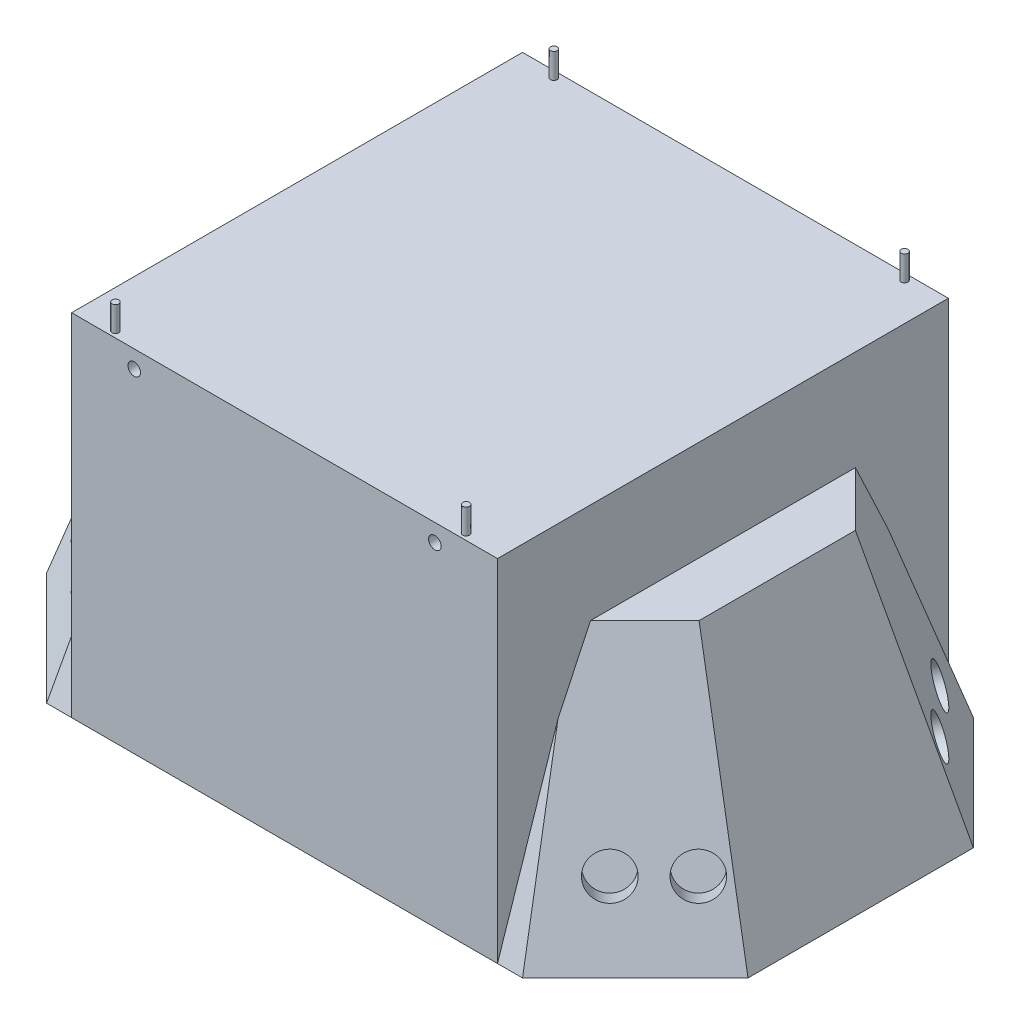
from build123d import *

# Parameters (mm, degrees)
BOSS_EXTRUDE1_DEPTH     = 100
BOSS_EXTRUDE1_TAPER     = 18.43
SKETCH2_W               = 170
SKETCH2_H               = 190
BOSS_EXTRUDE2_DEPTH     = 90
SKETCH3_R               = 1.35
BOSS_EXTRUDE3_DEPTH     = 10
SKETCH4_W               = 180
SKETCH4_H               = 50
CUT_EXTRUDE1_DEPTH      = 286.000000111
SKETCH5_R               = 2.5
CUT_EXTRUDE2_DEPTH      = 10
SKETCH6_R               = 8
CUT_EXTRUDE3_DEPTH      = 10
MIRROR4_COPY_1_SKETCH_R = 8
MIRROR4_COPY_1_DEPTH    = 10


with BuildPart() as part:
    # Sketch1 → Boss-Extrude1 (new body)
    with BuildSketch(Plane(origin=(0, 0, 0), x_dir=(1, 0, 0), z_dir=(0, 1, 0))):
        Polygon((-140, -45), (-125, -60), (-95, -90), (95, -90), (140, -45), (140, 45), (95, 90), (-95, 90), (-140, 45), align=None)
    extrude(amount=BOSS_EXTRUDE1_DEPTH, taper=BOSS_EXTRUDE1_TAPER)

    # Sketch2 → Boss-Extrude2 (add, symmetric)
    with BuildSketch(Plane.XY):
        with Locations((0, 45)):
            Rectangle(SKETCH2_W, SKETCH2_H)
    extrude(amount=BOSS_EXTRUDE2_DEPTH, both=True)

    # Sketch3 → Boss-Extrude3 (add, symmetric)
    with BuildSketch(Plane(origin=(0, 140, 0), x_dir=(1, 0, 0), z_dir=(0, 1, 0))):
        with Locations(Location((-70, 87.5, 0), (0, 0, 90))):
            Circle(SKETCH3_R)
        with Locations(Location((70, 87.5, 0), (0, 0, 90))):
            Circle(SKETCH3_R)
    boss_extrude3 = extrude(amount=BOSS_EXTRUDE3_DEPTH, both=True)

    # Mirror1: Boss-Extrude3 across plane
    add(boss_extrude3.mirror(Plane.XY))

    # Sketch4 → Cut-Extrude1 (cut, through all)
    with BuildSketch(Plane.ZY.offset(85)):
        with Locations((0, -25)):
            Rectangle(SKETCH4_W, SKETCH4_H)
    extrude(amount=-CUT_EXTRUDE1_DEPTH, mode=Mode.SUBTRACT)

    # Sketch5 → Cut-Extrude2 (cut)
    with BuildSketch(Plane(origin=(0, 0, -90), x_dir=(-1, 0, 0), z_dir=(0, 0, -1))):
        with Locations((-60, 133)):
            Circle(SKETCH5_R)
        with Locations((60, 133)):
            Circle(SKETCH5_R)
    cut_extrude2 = extrude(amount=-CUT_EXTRUDE2_DEPTH, mode=Mode.SUBTRACT)

    # Mirror2: Cut-Extrude2 across plane
    add(cut_extrude2.mirror(Plane.XY), mode=Mode.SUBTRACT)

    # Sketch6 → Cut-Extrude3 (cut)
    with BuildSketch(Plane(origin=(-83.254793164, 39.235386654, -83.254793164), x_dir=(-0.6068291050905237, 0.2859796255102721, 0.741602380665029), z_dir=(-0.6708397043943968, 0.31614582397380636, -0.6708397043943966))):
        with Locations(Location((23.427974197, -19.317213572, 0), (0, 0, 342.455867608))):
            Circle(SKETCH6_R)
        with Locations(Location((47.265100386, -26.853221472, 0), (0, 0, 342.455867608))):
            Circle(SKETCH6_R)
    cut_extrude3 = extrude(amount=-CUT_EXTRUDE3_DEPTH, mode=Mode.SUBTRACT)

    # Mirror3: Cut-Extrude3 across plane
    add(cut_extrude3.mirror(Plane.XY), mode=Mode.SUBTRACT)

    # Mirror4: Cut-Extrude3 across plane
    add(cut_extrude3.mirror(Plane(origin=(0, 0, 0), x_dir=(0, 0, 1), z_dir=(1, 0, 0))), mode=Mode.SUBTRACT)

    # Mirror4 copy 1 sketch → Mirror4 copy 1 (cut)
    with BuildSketch(Plane(origin=(83.254793164, 39.235386654, 83.254793164), x_dir=(0.6068291050905237, 0.2859796255102721, -0.741602380665029), z_dir=(0.6708397043943968, 0.31614582397380636, 0.6708397043943966))):
        with Locations(Location((23.427974197, -19.317213572, 0), (0, 0, 342.455867608))):
            Circle(MIRROR4_COPY_1_SKETCH_R)
        with Locations(Location((47.265100386, -26.853221472, 0), (0, 0, 342.455867608))):
            Circle(MIRROR4_COPY_1_SKETCH_R)
    extrude(amount=-MIRROR4_COPY_1_DEPTH, mode=Mode.SUBTRACT)


solid = part.part
